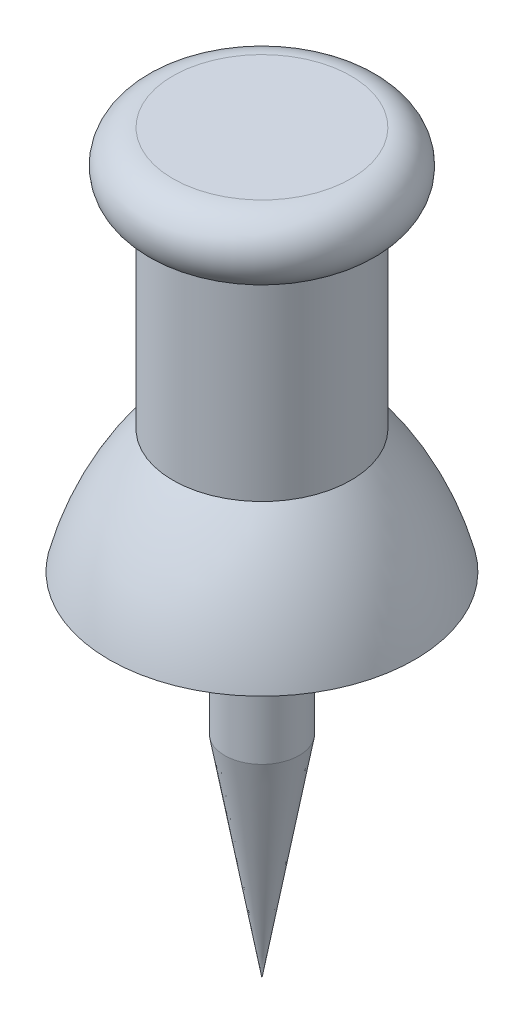
from build123d import *


with BuildPart() as part:
    # Sketch1 → Revolve1 (revolve)
    with BuildSketch(Plane.XY, mode=Mode.PRIVATE) as revolve1_sk:
        with BuildLine():
            Line((0, 36.603655235), (-3.373052236, 36.603655235))
            ThreePointArc((-3.373052236, 36.603655235), (-4.625116985, 35.351590486), (-3.373052236, 34.099525737))
            Line((-3.373052236, 34.099525737), (-3.373052236, 26.714297442))
            ThreePointArc((-3.373052236, 26.714297442), (-4.846489461, 24.51275357), (-5.783632018, 22.034936687))
            Line((-5.783632018, 22.034936687), (-1.410896796, 22.034936687))
            Line((-1.410896796, 22.034936687), (-1.410896796, 16.708697696))
            Line((-1.410896796, 16.708697696), (0, 8.705848478))
            Line((0, 8.705848478), (0, 36.603655235))
        make_face()
    revolve(revolve1_sk.sketch.rotate(Axis((0, 41.789122373, 0), (0, -1, 0)), 270), axis=Axis((0, 41.789122373, 0), (0, -1, 0)))


solid = part.part
